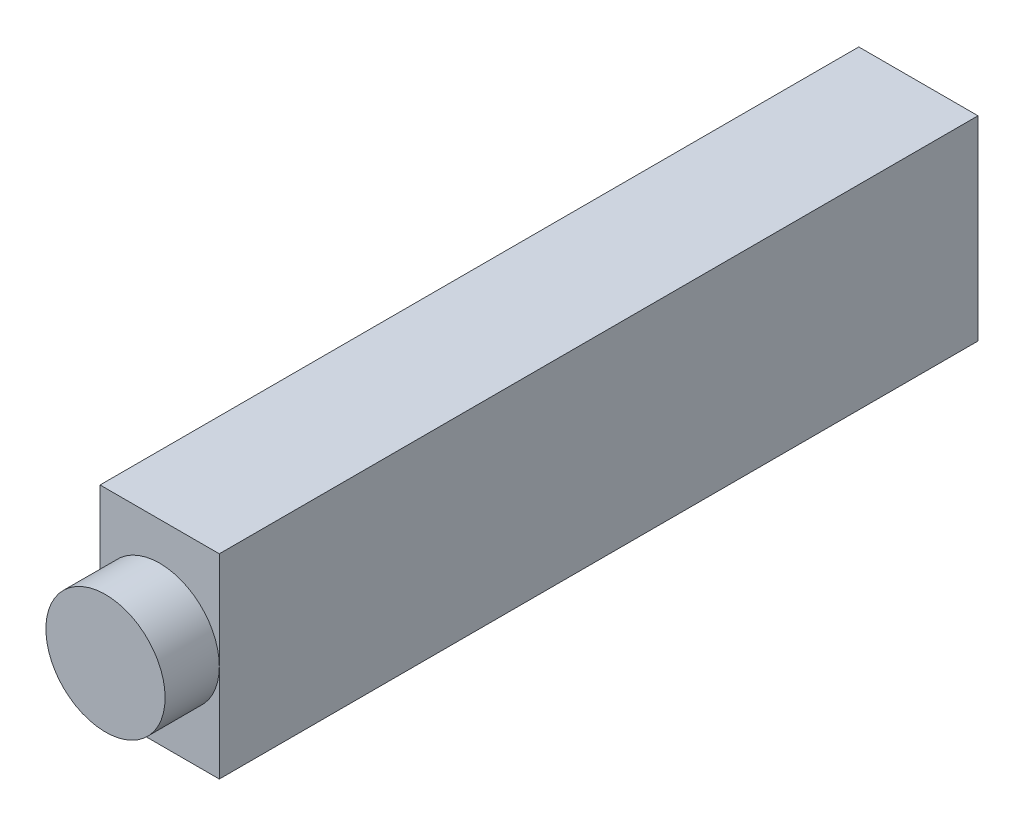
from build123d import *

# Parameters (mm, degrees)
SKETCH1_R           = 11
BOSS_EXTRUDE1_DEPTH = 10
SKETCH3_W           = 22
SKETCH3_H           = 36
BOSS_EXTRUDE2_DEPTH = 140


with BuildPart() as part:
    # Sketch1 → Boss-Extrude1 (new body)
    with BuildSketch(Plane.XY):
        Circle(SKETCH1_R)
    extrude(amount=BOSS_EXTRUDE1_DEPTH)

    # Sketch3 → Boss-Extrude2 (add)
    with BuildSketch(Plane(origin=(0, 0, 0), x_dir=(-1, 0, 0), z_dir=(0, 0, -1))):
        Rectangle(SKETCH3_W, SKETCH3_H)
    extrude(amount=BOSS_EXTRUDE2_DEPTH)


solid = part.part
